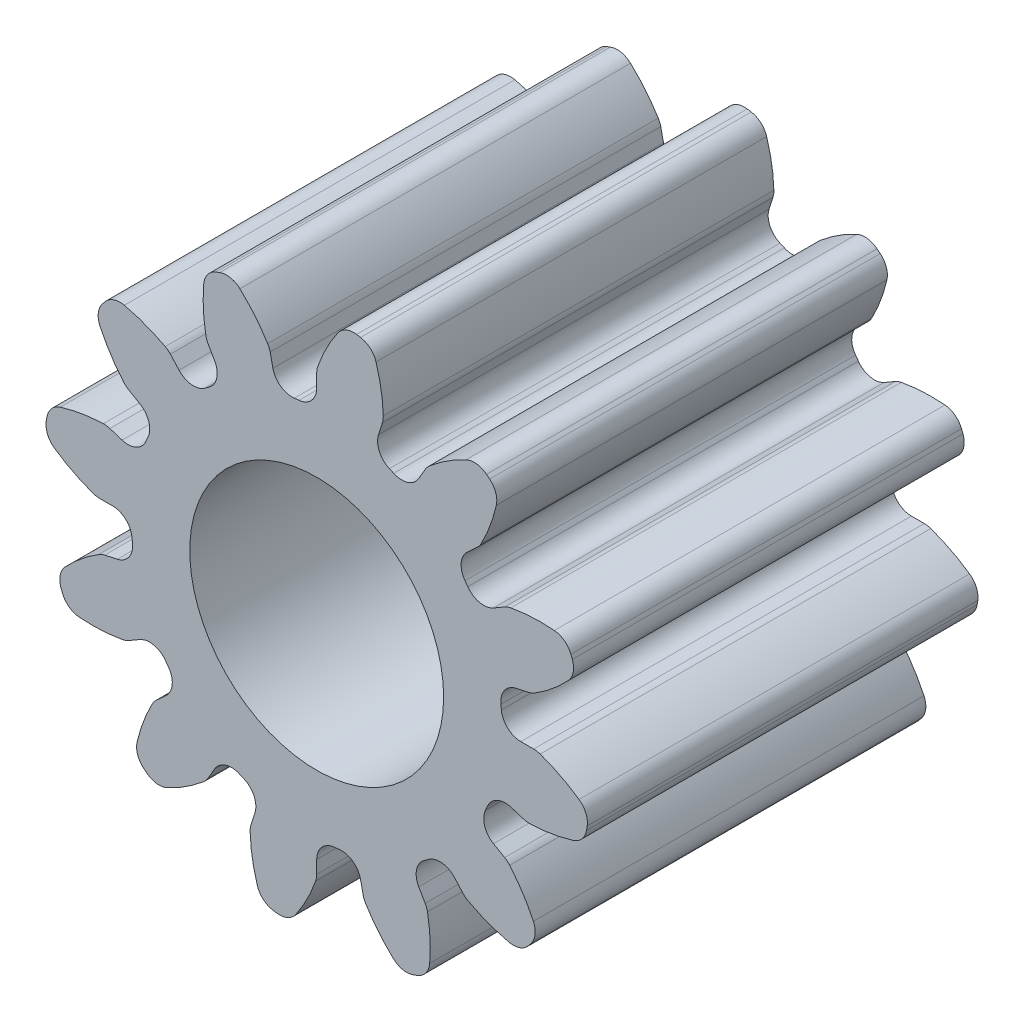
from build123d import *

# Parameters (mm, degrees)
SKETCH1_R                = 3.25
BOSS_EXTRUDE5_DEPTH      = 10
BOSS_EXTRUDE8_DEPTH      = 10
FILLET6_R                = 0.5
CIRPATTERN1_COUNT        = 12
FILLET6_OF_CIRPATTERN1_R = 0.5


with BuildPart() as part:
    # Sketch1 → Boss-Extrude5 (new body)
    with BuildSketch(Plane(origin=(0, 0, 0), x_dir=(0, 1, 0), z_dir=(0, 0, 1))):
        with BuildLine():
            ThreePointArc((1.437492243, 4.527263638), (0.727323078, 4.693985635), (0, 4.75))
            ThreePointArc((0, 4.75), (-3.358757211, -3.358757211), (4.75, 0))
            ThreePointArc((4.75, 0), (3.833444153, 2.804853993), (1.437492243, 4.527263638))
        make_face()
        Circle(SKETCH1_R, mode=Mode.SUBTRACT)
    extrude(amount=BOSS_EXTRUDE5_DEPTH)

    # Sketch1<14> → Boss-Extrude8 (add)
    with BuildSketch(Plane(origin=(0, 0, 0), x_dir=(0, 1, 0), z_dir=(0, 0, 1))):
        with BuildLine():
            ThreePointArc((0.722805705, 6.962582273), (0.300709769, 6.333492245), (0, 5.638155725))
            Line((0, 5.638155725), (0, 4.75))
            ThreePointArc((0, 4.75), (0.727323078, 4.693985635), (1.437492243, 4.527263638))
            Line((1.437492243, 4.527263638), (1.706274762, 5.373772084))
            ThreePointArc((1.706274762, 5.373772084), (1.630095489, 6.127506759), (1.4181739, 6.854836452))
            ThreePointArc((1.4181739, 6.854836452), (1.071844535, 6.917452515), (0.722805705, 6.962582273))
        make_face()
    boss_extrude8 = extrude(amount=BOSS_EXTRUDE8_DEPTH)

    # Fillet6
    fillet6_edges = [part.edges().sort_by_distance(p)[0] for p in [
        (-6.854836452, 1.4181739, 5),
        (-6.962582273, 0.722805705, 5),
        (-5.638155725, 0, 5),
        (-4.75, 0, 5),
        (-5.373772084, 1.706274762, 5),
        (-4.527263638, 1.437492243, 5),
    ]]
    fillet(fillet6_edges, radius=FILLET6_R)

    # CirPattern1: Boss-Extrude8 ×12 about axis
    cirpattern1_axis = Axis((0, 0, 10), (0, 0, -1))
    for i in range(1, CIRPATTERN1_COUNT):
        add(boss_extrude8.rotate(cirpattern1_axis, i * 360 / CIRPATTERN1_COUNT))

    # Fillet6 of CirPattern1
    fillet6_of_cirpattern1_edges = [part.edges().sort_by_distance(p)[0] for p in [
        (-5.227375557, 4.655592851, 5),
        (-5.668370272, 4.107259239, 5),
        (-4.882786088, 2.819077862, 5),
        (-4.113620668, 2.375, 5),
        (-3.800685758, 4.164563332, 5),
        (-3.201979199, 3.50853662, 5),
        (-2.199243602, 6.645549457, 5),
        (-2.855323034, 6.391175977, 5),
        (-2.819077862, 4.882786088, 5),
        (-2.375, 4.113620668, 5),
        (-1.209208752, 5.50696052, 5),
        (-1.018727019, 4.639471442, 5),
        (1.4181739, 6.854836452, 5),
        (0.722805705, 6.962582273, 5),
        (0, 5.638155725, 5),
        (0, 4.75, 5),
        (1.706274762, 5.373772084, 5),
        (1.437492243, 4.527263638, 5),
        (4.655592851, 5.227375557, 5),
        (4.107259239, 5.668370272, 5),
        (2.819077862, 4.882786088, 5),
        (2.375, 4.113620668, 5),
        (4.164563332, 3.800685758, 5),
        (3.50853662, 3.201979199, 5),
        (6.645549457, 2.199243602, 5),
        (6.391175977, 2.855323034, 5),
        (4.882786088, 2.819077862, 5),
        (4.113620668, 2.375, 5),
        (5.50696052, 1.209208752, 5),
        (4.639471442, 1.018727019, 5),
        (6.854836452, -1.4181739, 5),
        (6.962582273, -0.722805705, 5),
        (5.638155725, 0, 5),
        (4.75, 0, 5),
        (5.373772084, -1.706274762, 5),
        (4.527263638, -1.437492243, 5),
        (5.227375557, -4.655592851, 5),
        (5.668370272, -4.107259239, 5),
        (4.882786088, -2.819077862, 5),
        (4.113620668, -2.375, 5),
        (3.800685758, -4.164563332, 5),
        (3.201979199, -3.50853662, 5),
        (2.199243602, -6.645549457, 5),
        (2.855323034, -6.391175977, 5),
        (2.819077862, -4.882786088, 5),
        (2.375, -4.113620668, 5),
        (1.209208752, -5.50696052, 5),
        (1.018727019, -4.639471442, 5),
        (-1.4181739, -6.854836452, 5),
        (-0.722805705, -6.962582273, 5),
        (0, -5.638155725, 5),
        (0, -4.75, 5),
        (-1.706274762, -5.373772084, 5),
        (-1.437492243, -4.527263638, 5),
        (-4.655592851, -5.227375557, 5),
        (-4.107259239, -5.668370272, 5),
        (-2.819077862, -4.882786088, 5),
        (-2.375, -4.113620668, 5),
        (-4.164563332, -3.800685758, 5),
        (-3.50853662, -3.201979199, 5),
        (-6.645549457, -2.199243602, 5),
        (-6.391175977, -2.855323034, 5),
        (-4.882786088, -2.819077862, 5),
        (-4.113620668, -2.375, 5),
        (-5.50696052, -1.209208752, 5),
        (-4.639471442, -1.018727019, 5),
    ]]
    fillet(fillet6_of_cirpattern1_edges, radius=FILLET6_OF_CIRPATTERN1_R)


solid = part.part
